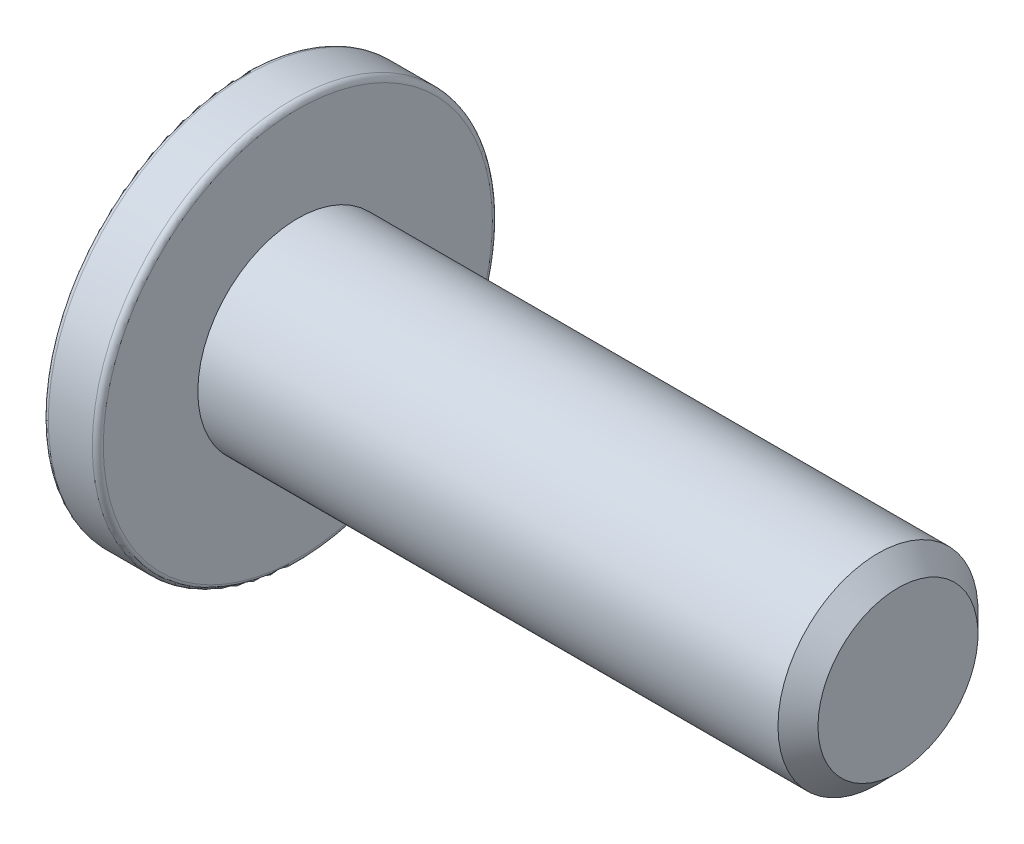
from build123d import *

# Parameters (mm, degrees)
CUT_EXTRUDE_1_DEPTH = 0.55


with BuildPart() as part:
    # 草图1 → 旋转1 (revolve)
    with BuildSketch(Plane.XY, mode=Mode.PRIVATE) as revolve_1_sk:
        Polygon((12, 1.6), (11.6, 2), (0, 2), (0, 0), (12, 0), align=None)
        with BuildLine():
            Line((-0.11, 4), (-0.99, 4))
            ThreePointArc((-0.99, 4), (-1.067781746, 3.967781746), (-1.1, 3.89))
            Line((-1.1, 3.89), (-1.1, 0))
            Line((-1.1, 0), (0, 0))
            Line((0, 0), (0, 3.89))
            ThreePointArc((0, 3.89), (-0.032218254, 3.967781746), (-0.11, 4))
        make_face()
    revolve(revolve_1_sk.sketch.rotate(Axis((0, 0, 0), (1, 0, 0)), 90), axis=Axis((0, 0, 0), (1, 0, 0)))

    # 草图2 → 切除-拉伸1 (cut)
    with BuildSketch(Plane.ZY.offset(1.1)):
        Polygon((1.25, -0.721687836), (1.25, 0.721687836), (0, 1.443375673), (-1.25, 0.721687836), (-1.25, -0.721687836), (0, -1.443375673), align=None)
    extrude(amount=-CUT_EXTRUDE_1_DEPTH, mode=Mode.SUBTRACT)


solid = part.part
